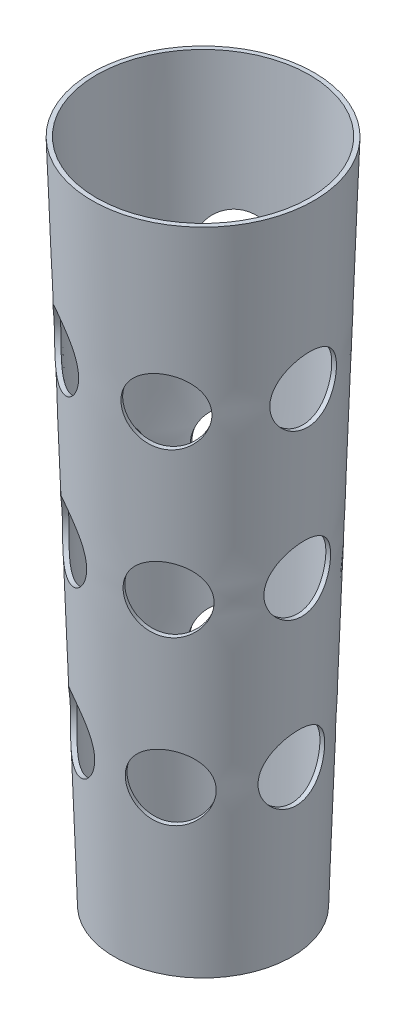
from build123d import *

# Parameters (mm, degrees)
SKETCH_2_R               = 0.75
CUT_EXTRUDE_1_DEPTH      = 5
PATTERN_CIRCULAR_1_COUNT = 3


with BuildPart() as part:
    # Эскиз1 → Повернуть-Тонкостенный1 (revolve)
    with BuildSketch(Plane.XY, mode=Mode.PRIVATE) as revolve_1_sk:
        Polygon((0, 0), (-2, 0), (-2.5, 15), (-2.400055509, 15.003331483), (-1.903277793, 0.1), (0, 0.1), align=None)
    revolve(revolve_1_sk.sketch.rotate(Axis((0, 0, 0), (0, 1, 0)), 270), axis=Axis((0, 0, 0), (0, 1, 0)))

    # Эскиз2 → Вырез-Вытянуть1 (cut, symmetric)
    with BuildSketch(Plane(origin=(0, 0, 0), x_dir=(0, 0, -1), z_dir=(1, 0, 0))):
        with Locations(Location((0, 3.750832871, 0), (0, 0, 313.941017434))):
            Circle(SKETCH_2_R)
        with Locations(Location((0, 7.501665742, 0), (0, 0, 314.872250795))):
            Circle(SKETCH_2_R)
        with Locations(Location((0, 11.252498612, 0), (0, 0, 304.892822739))):
            Circle(SKETCH_2_R)
    cut_extrude_1 = extrude(amount=CUT_EXTRUDE_1_DEPTH, both=True, mode=Mode.SUBTRACT)

    # Круговой массив1: Вырез-Вытянуть1 ×3 about axis
    pattern_circular_1_axis = Axis((0, 15, 0), (0, -1, 0))
    for i in range(1, PATTERN_CIRCULAR_1_COUNT):
        add(cut_extrude_1.rotate(pattern_circular_1_axis, i * 360 / PATTERN_CIRCULAR_1_COUNT), mode=Mode.SUBTRACT)


solid = part.part
